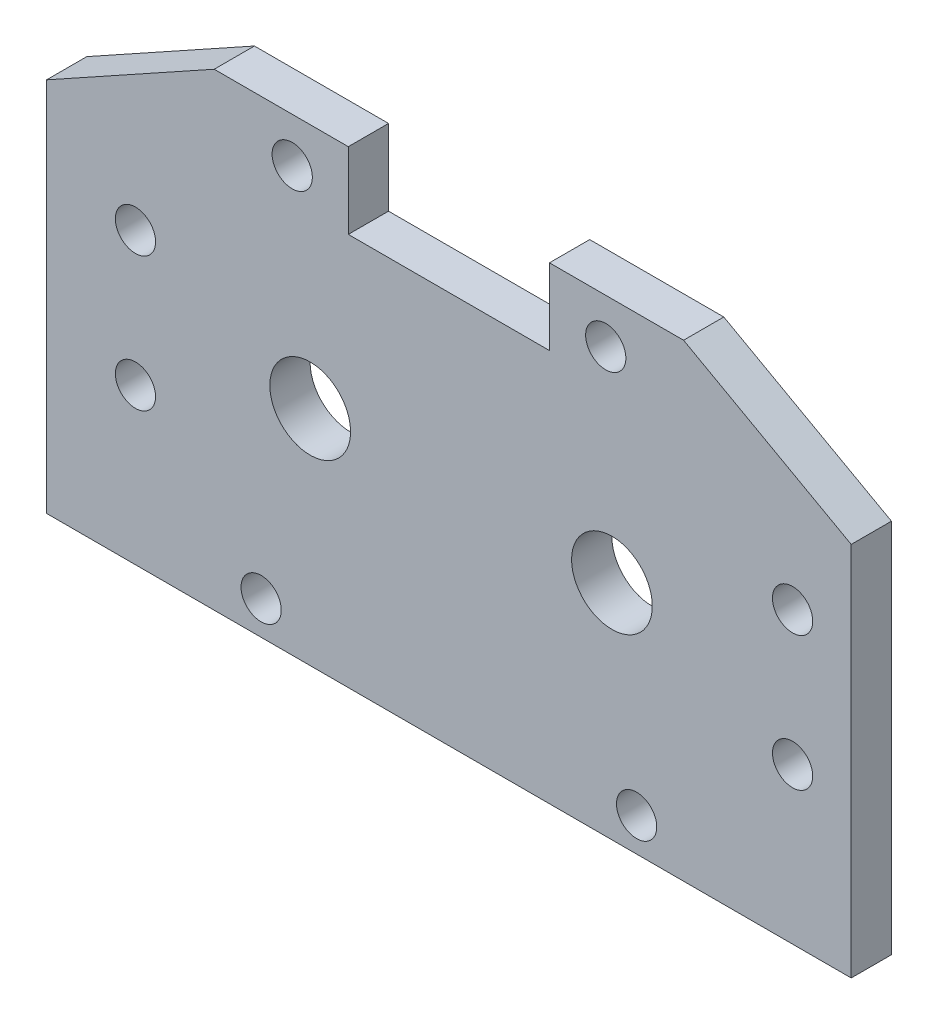
from build123d import *

# Parameters (mm, degrees)
EXTRUDE_1_DEPTH      = 3
SKETCH_2_R           = 1.5
CUT_EXTRUDE_7_DEPTH  = 43.02014847
SKETCH_4_R           = 1.5
CUT_EXTRUDE_8_DEPTH  = 43.02014847
SKETCH_5_R           = 3.01
CUT_EXTRUDE_9_DEPTH  = 43.02014847
SKETCH_6_R           = 1.5
CUT_EXTRUDE_10_DEPTH = 43.02014847


with BuildPart() as part:
    # 草图1 → 凸台-拉伸1 (new body)
    with BuildSketch(Plane.XY):
        Polygon((-7.5, 0), (7.5, 0), (7.5, 5.665837688), (17.5, 5.665837688), (30, -1.269316313), (30, -29.269316313), (-30, -29.269316313), (-30, -1.269316313), (-17.5, 5.665837688), (-7.5, 5.665837688), align=None)
    extrude(amount=EXTRUDE_1_DEPTH)

    # 草图2 → 切除-拉伸7 (cut, through all)
    with BuildSketch(Plane(origin=(0, 0, 0), x_dir=(-1, 0, 0), z_dir=(0, 0, -1))):
        with Locations((-25.62844718, -17.669380188)):
            Circle(SKETCH_2_R)
        with Locations((-25.62844718, -7.669380188)):
            Circle(SKETCH_2_R)
        with Locations((23.37155282, -17.669380188)):
            Circle(SKETCH_2_R)
        with Locations((23.37155282, -7.669380188)):
            Circle(SKETCH_2_R)
    extrude(amount=-CUT_EXTRUDE_7_DEPTH, mode=Mode.SUBTRACT)

    # 草图4 → 切除-拉伸8 (cut, through all)
    with BuildSketch(Plane(origin=(0, 0, 0), x_dir=(-1, 0, 0), z_dir=(0, 0, -1))):
        with Locations((-11.696832964, 2.350343297)):
            Circle(SKETCH_4_R)
        with Locations((11.682164636, 2.350343297)):
            Circle(SKETCH_4_R)
    extrude(amount=-CUT_EXTRUDE_8_DEPTH, mode=Mode.SUBTRACT)

    # 草图5 → 切除-拉伸9 (cut, through all)
    with BuildSketch(Plane(origin=(0, 0, 0), x_dir=(-1, 0, 0), z_dir=(0, 0, -1))):
        with Locations((10.34155282, -12.669316313)):
            Circle(SKETCH_5_R)
        with Locations((-12.15844718, -12.669380188)):
            Circle(SKETCH_5_R)
    extrude(amount=-CUT_EXTRUDE_9_DEPTH, mode=Mode.SUBTRACT)

    # 草图6 → 切除-拉伸10 (cut, through all)
    with BuildSketch(Plane(origin=(0, 0, 0), x_dir=(-1, 0, 0), z_dir=(0, 0, -1))):
        with Locations((14, -26.769316313)):
            Circle(SKETCH_6_R)
        with Locations((-14, -26.769316313)):
            Circle(SKETCH_6_R)
    extrude(amount=-CUT_EXTRUDE_10_DEPTH, mode=Mode.SUBTRACT)


solid = part.part
